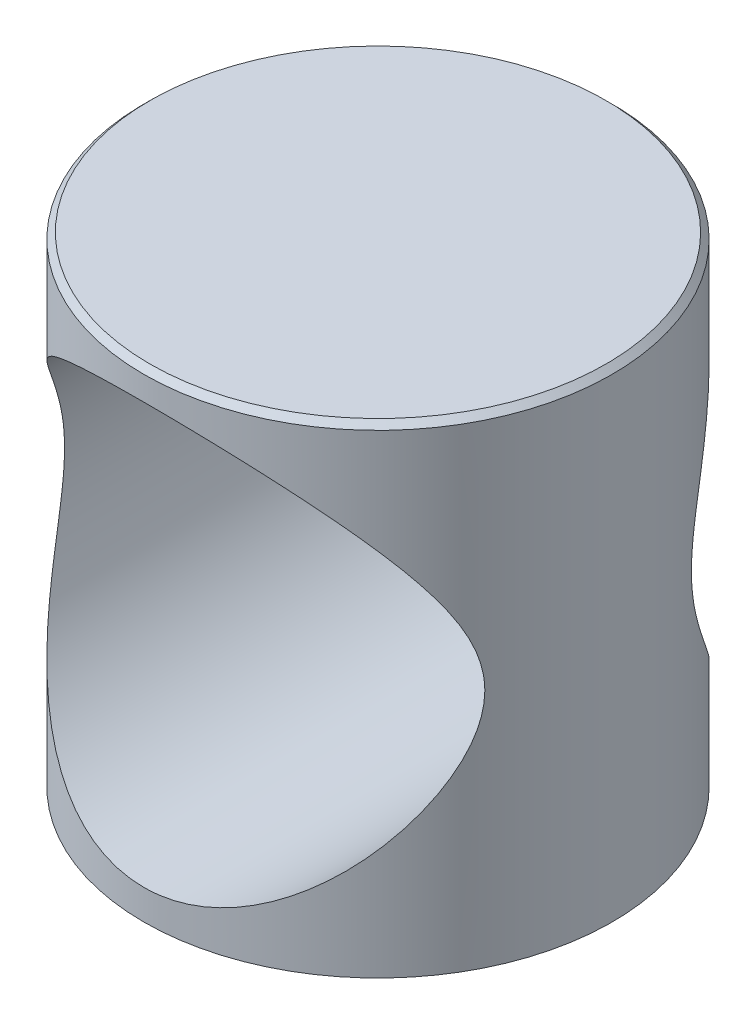
from build123d import *

# Parameters (mm, degrees)
SCHIZZO1_R        = 39
ESTRUSIONE1_DEPTH = 40
SCHIZZO3_R        = 35
ESTRUSIONE3_DEPTH = 40
SMUSSO1_SIZE      = 1


with BuildPart() as part:
    # Schizzo1 → Estrusione1 (new, symmetric)
    with BuildSketch(Plane(origin=(0, 0, 0), x_dir=(1, 0, 0), z_dir=(0, 1, 0))):
        with Locations(Location((0, 0, 0), (0, 0, 270))):
            Circle(SCHIZZO1_R)
    extrude(amount=ESTRUSIONE1_DEPTH, both=True)

    # Schizzo3 → Estrusione3 (cut, symmetric)
    with BuildSketch(Plane.XY):
        with Locations(Location((0, 0, 0), (0, 0, 90))):
            Circle(SCHIZZO3_R)
    extrude(amount=ESTRUSIONE3_DEPTH, both=True, mode=Mode.SUBTRACT)

    # Smusso1
    smusso1_edges = [part.edges().sort_by_distance(p)[0] for p in [
        (0, 40, -39),
    ]]
    chamfer(smusso1_edges, length=SMUSSO1_SIZE)


solid = part.part
